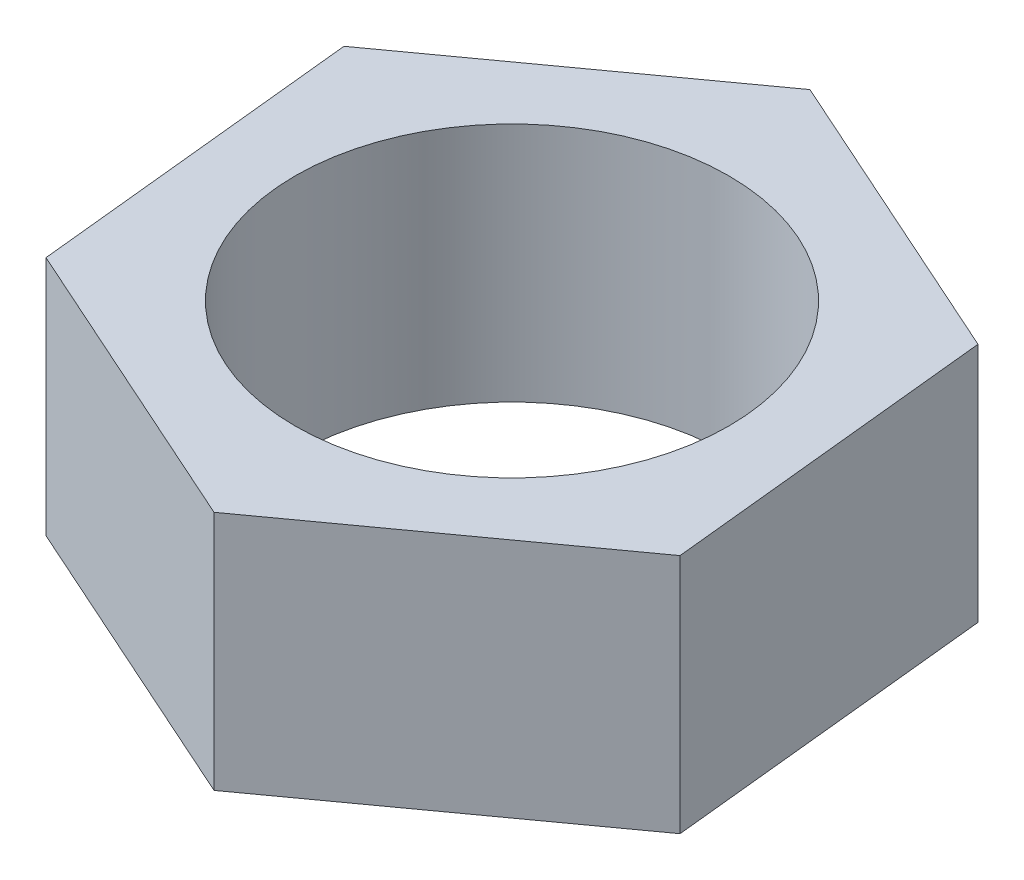
from build123d import *

# Parameters (mm, degrees)
SKETCH1_R           = 9
BOSS_EXTRUDE1_DEPTH = 10


with BuildPart() as part:
    # Sketch1 → Boss-Extrude1 (new body)
    with BuildSketch(Plane(origin=(0, 0, 0), x_dir=(1, 0, 0), z_dir=(0, 1, 0))):
        Polygon((11.230528464, 8.116355736), (-1.413706022, 13.784100815), (-12.644234485, 5.667745079), (-11.230528464, -8.116355736), (1.413706022, -13.784100815), (12.644234485, -5.667745079), align=None)
        with Locations(Location((0, 0, 0), (0, 0, 270))):
            Circle(SKETCH1_R, mode=Mode.SUBTRACT)
    extrude(amount=BOSS_EXTRUDE1_DEPTH)


solid = part.part
